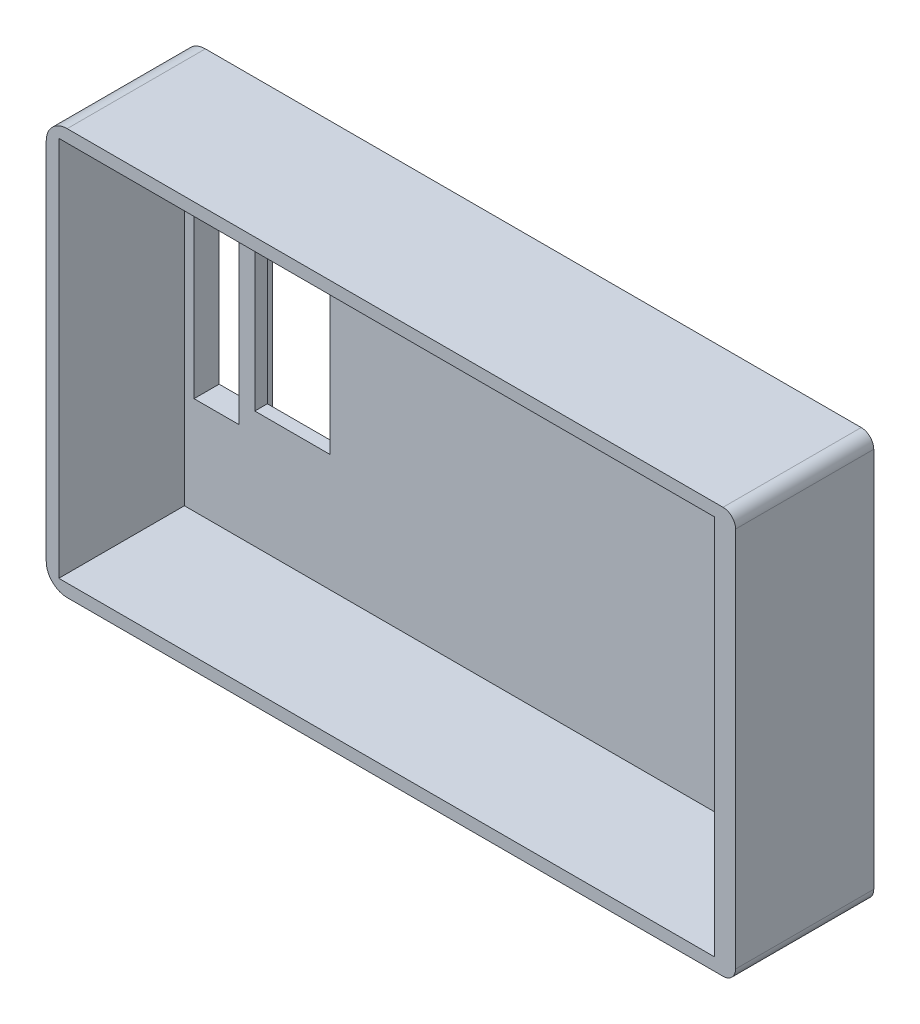
from build123d import *

# Parameters (mm, degrees)
CROQUIS1_W                = 10.714275766
CROQUIS1_H                = 44.4
SALIENTE_EXTRUIR1_DEPTH   = 3
SALIENTE_EXTRUIR1_2_DEPTH = 3
CROQUIS2_W                = 143.628551532
CROQUIS2_H                = 97
CROQUIS2_W_2              = 17.964463827
CROQUIS2_H_2              = 35
CROQUIS2_W_3              = 10.714275766
CROQUIS2_H_3              = 44.4
SALIENTE_EXTRUIR2_DEPTH   = 3
CROQUIS3_W                = 143.628551532
CROQUIS3_H                = 97
CROQUIS3_W_2              = 137.628551532
CROQUIS3_H_2              = 91
SALIENTE_EXTRUIR3_DEPTH   = 30
REDONDEO1_R               = 5
CROQUIS4_W                = 35.073435796
CROQUIS4_H                = 97.224073942
CORTAR_EXTRUIR1_DEPTH     = 5
CORTAR_EXTRUIR2_START     = -3
CROQUIS6_W                = 10.714275766
CROQUIS6_H                = 44.4
CORTAR_EXTRUIR2_DEPTH     = 3
CROQUIS7_W                = 3
CROQUIS7_H                = 44.4
SALIENTE_EXTRUIR4_DEPTH   = 11
SALIENTE_EXTRUIR5_DEPTH   = 26
CROQUIS9_W                = 5
CROQUIS9_H                = 91
SALIENTE_EXTRUIR6_DEPTH   = 30
REDONDEO2_R               = 3


with BuildPart() as part:
    # Croquis1 → Saliente-Extruir1 (new body)
    with BuildSketch(Plane.XY):
        with BuildLine():
            ThreePointArc((-54.8, 72.7), (-54.092893219, 72.407106781), (-53.8, 71.7))
            Line((-53.8, 71.7), (-53.8, 25.3))
            ThreePointArc((-53.8, 25.3), (-54.092893219, 24.592893219), (-54.8, 24.3))
            Line((-54.8, 24.3), (-67.514275766, 24.3))
            ThreePointArc((-67.514275766, 24.3), (-68.221382548, 24.592893219), (-68.514275766, 25.3))
            Line((-68.514275766, 25.3), (-68.514275766, 71.7))
            ThreePointArc((-68.514275766, 71.7), (-68.221382548, 72.407106781), (-67.514275766, 72.7))
            Line((-67.514275766, 72.7), (-54.8, 72.7))
        make_face()
        with Locations((-61.157137883, 48.5)):
            Rectangle(CROQUIS1_W, CROQUIS1_H, mode=Mode.SUBTRACT)
    extrude(amount=-SALIENTE_EXTRUIR1_DEPTH)



with BuildPart() as body_2:
    # Croquis1 → Saliente-Extruir1 2 (new body)
    with BuildSketch(Plane.XY):
        with BuildLine():
            ThreePointArc((68.514275766, 25.3), (68.221382548, 24.592893219), (67.514275766, 24.3))
            Line((67.514275766, 24.3), (54.8, 24.3))
            ThreePointArc((54.8, 24.3), (54.092893219, 24.592893219), (53.8, 25.3))
            Line((53.8, 25.3), (53.8, 71.7))
            ThreePointArc((53.8, 71.7), (54.092893219, 72.407106781), (54.8, 72.7))
            Line((54.8, 72.7), (67.514275766, 72.7))
            ThreePointArc((67.514275766, 72.7), (68.221382548, 72.407106781), (68.514275766, 71.7))
            Line((68.514275766, 71.7), (68.514275766, 25.3))
        make_face()
        with Locations((61.157137883, 48.5)):
            Rectangle(CROQUIS1_W, CROQUIS1_H, mode=Mode.SUBTRACT)
    extrude(amount=-SALIENTE_EXTRUIR1_2_DEPTH)


with BuildPart() as part_1:
    add(part.part)

    add(body_2.part)  # Saliente-Extruir2 merges body 2
    # Croquis2 → Saliente-Extruir2 (add)
    with BuildSketch(Plane.XY):
        with Locations((0, 48.5)):
            Rectangle(CROQUIS2_W, CROQUIS2_H)
        with Locations((-43.017768086, 48.5)):
            Rectangle(CROQUIS2_W_2, CROQUIS2_H_2, mode=Mode.SUBTRACT)
        with Locations((61.157137883, 48.5)):
            Rectangle(CROQUIS2_W_3, CROQUIS2_H_3, mode=Mode.SUBTRACT)
        with Locations((-61.157137883, 48.5)):
            Rectangle(CROQUIS2_W_3, CROQUIS2_H_3, mode=Mode.SUBTRACT)
    extrude(amount=SALIENTE_EXTRUIR2_DEPTH)

    # Croquis3 → Saliente-Extruir3 (add)
    with BuildSketch(Plane.XY.offset(3)):
        with Locations((0, 48.5)):
            Rectangle(CROQUIS3_W, CROQUIS3_H)
        with Locations((0, 48.5)):
            Rectangle(CROQUIS3_W_2, CROQUIS3_H_2, mode=Mode.SUBTRACT)
    extrude(amount=SALIENTE_EXTRUIR3_DEPTH)

    # Redondeo1
    redondeo1_edges = [part_1.edges().sort_by_distance(p)[0] for p in [
        (71.814275766, 0, 16.5),
        (71.814275766, 97, 16.5),
        (-71.814275766, 97, 16.5),
        (-71.814275766, 0, 16.5),
    ]]
    fillet(redondeo1_edges, radius=REDONDEO1_R)

    # Croquis4 → Cortar-Extruir1 (cut)
    with BuildSketch(Plane(origin=(71.814275766, 0, 0), x_dir=(0, 0, -1), z_dir=(1, 0, 0))):
        with Locations((-17.536717898, 48.612036971)):
            Rectangle(CROQUIS4_W, CROQUIS4_H)
    extrude(amount=-CORTAR_EXTRUIR1_DEPTH, mode=Mode.SUBTRACT)

    # Croquis6 → Cortar-Extruir2 (cut)
    with BuildSketch(Plane(origin=(0, 0, -3), x_dir=(-1, 0, 0), z_dir=(0, 0, -1)).offset(CORTAR_EXTRUIR2_START)):
        with BuildLine():
            Line((-67.514275766, 24.3), (-54.8, 24.3))
            ThreePointArc((-54.8, 24.3), (-54.092893219, 24.592893219), (-53.8, 25.3))
            Line((-53.8, 25.3), (-53.8, 71.7))
            ThreePointArc((-53.8, 71.7), (-54.092893219, 72.407106781), (-54.8, 72.7))
            Line((-54.8, 72.7), (-67.514275766, 72.7))
            ThreePointArc((-67.514275766, 72.7), (-68.221382548, 72.407106781), (-68.514275766, 71.7))
            Line((-68.514275766, 71.7), (-68.514275766, 25.3))
            ThreePointArc((-68.514275766, 25.3), (-68.221382548, 24.592893219), (-67.514275766, 24.3))
        make_face()
        with Locations((-61.157137883, 48.5)):
            Rectangle(CROQUIS6_W, CROQUIS6_H, mode=Mode.SUBTRACT)
    extrude(amount=CORTAR_EXTRUIR2_DEPTH, mode=Mode.SUBTRACT)

    # Croquis7 → Saliente-Extruir4 (add)
    with BuildSketch(Plane(origin=(55.8, 0, 0), x_dir=(0, 0, -1), z_dir=(1, 0, 0))):
        with Locations((-1.5, 48.5)):
            Rectangle(CROQUIS7_W, CROQUIS7_H)
    extrude(amount=SALIENTE_EXTRUIR4_DEPTH)

    # Croquis8 → Saliente-Extruir5 (add)
    with BuildSketch(Plane(origin=(66.814275766, 0, 0), x_dir=(0, 0, -1), z_dir=(1, 0, 0))):
        Polygon((-33, 0), (0, 0), (0, 97), (-33, 97), (-33, 94), (-3, 94), (-3, 3), (-33, 3), align=None)
    extrude(amount=SALIENTE_EXTRUIR5_DEPTH)

    # Croquis9 → Saliente-Extruir6 (add)
    with BuildSketch(Plane.XY.offset(3)):
        with Locations((90.314275766, 48.5)):
            Rectangle(CROQUIS9_W, CROQUIS9_H)
    extrude(amount=SALIENTE_EXTRUIR6_DEPTH)

    # Redondeo2
    redondeo2_edges = [part_1.edges().sort_by_distance(p)[0] for p in [
        (92.814275766, 0, 16.5),
        (92.814275766, 97, 16.5),
    ]]
    fillet(redondeo2_edges, radius=REDONDEO2_R)


solid = part_1.part
